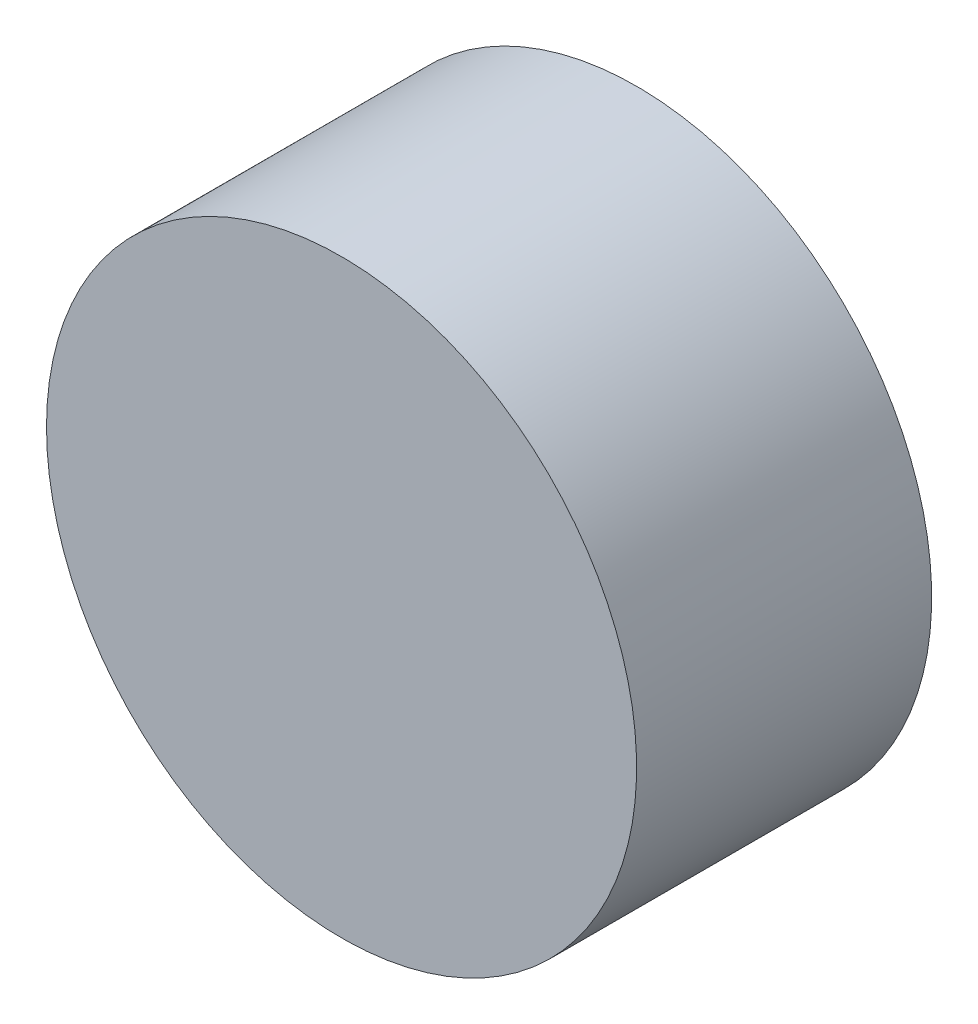
from build123d import *

# Parameters (mm, degrees)
SKETCH1_R           = 76.2
BOSS_EXTRUDE1_DEPTH = 76.2


with BuildPart() as part:
    # Sketch1 → Boss-Extrude1 (new body)
    with BuildSketch(Plane.XY):
        with Locations(Location((-19.593848005, 20.601008417, 0), (0, 0, 180))):
            Circle(SKETCH1_R)
    extrude(amount=BOSS_EXTRUDE1_DEPTH)


solid = part.part
